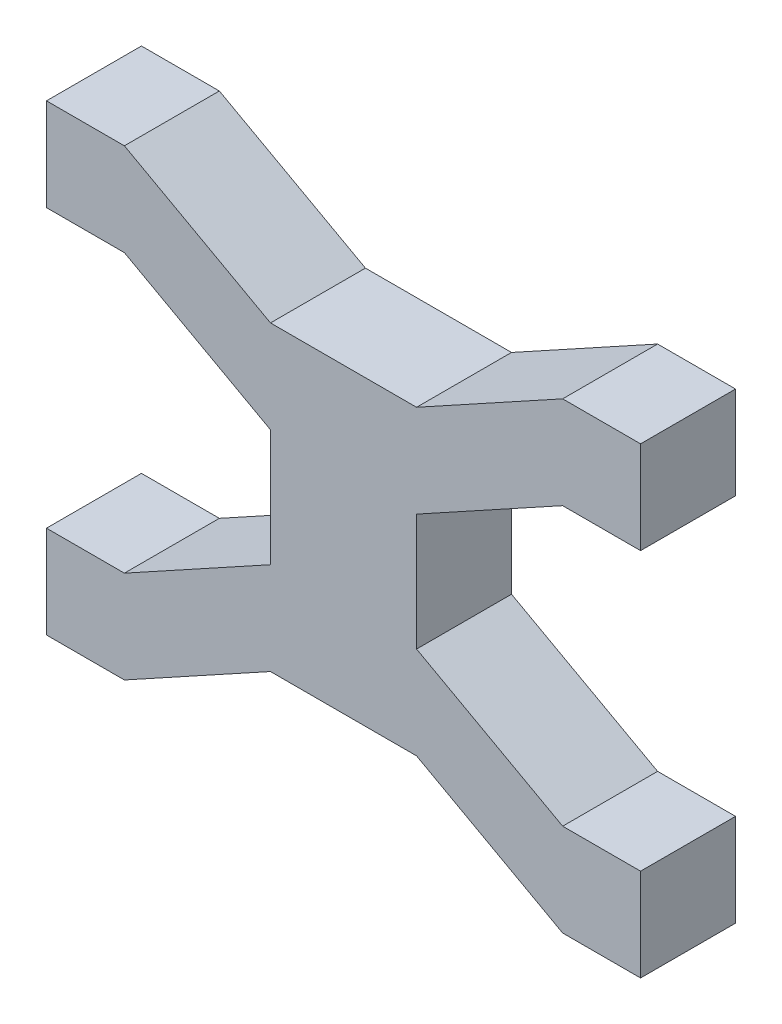
from build123d import *

# Parameters (mm, degrees)
AUFSATZ_LINEAR_AUSTRAGEN1_DEPTH = 9.75


with BuildPart() as part:
    # Skizze1 → Aufsatz-Linear austragen1 (new body)
    with BuildSketch(Plane.XY):
        Polygon((-30.5, 14.25), (-30.5, 23.75), (-22.5, 23.75), (-7.5, 15.5), (7.5, 15.5), (22.5, 23.75), (30.5, 23.75), (30.5, 14.25), (22.5, 14.25), (7.5, 6), (7.5, -6), (22.5, -14.25), (30.5, -14.25), (30.5, -23.75), (22.5, -23.75), (7.5, -15.5), (-7.5, -15.5), (-22.5, -23.75), (-30.5, -23.75), (-30.5, -14.25), (-22.5, -14.25), (-7.5, -6), (-7.5, 6), (-22.5, 14.25), align=None)
    extrude(amount=AUFSATZ_LINEAR_AUSTRAGEN1_DEPTH)


solid = part.part
